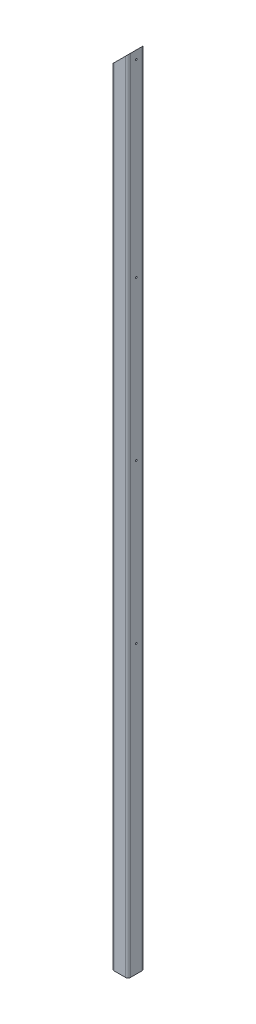
from build123d import *

# Parameters (mm, degrees)
TUBE_SQUARE_40_X_40_X_3_2_1_DEPTH = 1920
CUT_EXTRUDE1_DEPTH                = 1921.52076271
SKETCH16_R                        = 2
CUT_EXTRUDE2_DEPTH                = 3


with BuildPart() as part:
    # Sketch15 → Tube (square) 40 X 40 X 3.2(1) (new body)
    with BuildSketch(Plane(origin=(0, 0, 0), x_dir=(-1, 0, 0), z_dir=(0, 1, 0))):
        with BuildLine():
            Line((-13.6, -20), (13.6, -20))
            ThreePointArc((13.6, -20), (18.1254834, -18.1254834), (20, -13.6))
            Line((20, -13.6), (20, 13.6))
            ThreePointArc((20, 13.6), (18.1254834, 18.1254834), (13.6, 20))
            Line((13.6, 20), (-13.6, 20))
            ThreePointArc((-13.6, 20), (-18.1254834, 18.1254834), (-20, 13.6))
            Line((-20, 13.6), (-20, -13.6))
            ThreePointArc((-20, -13.6), (-18.1254834, -18.1254834), (-13.6, -20))
        make_face()
        with BuildLine():
            Line((-13.6, -16.8), (13.6, -16.8))
            ThreePointArc((13.6, -16.8), (15.8627417, -15.8627417), (16.8, -13.6))
            Line((16.8, -13.6), (16.8, 13.6))
            ThreePointArc((16.8, 13.6), (15.8627417, 15.8627417), (13.6, 16.8))
            Line((13.6, 16.8), (-13.6, 16.8))
            ThreePointArc((-13.6, 16.8), (-15.8627417, 15.8627417), (-16.8, 13.6))
            Line((-16.8, 13.6), (-16.8, -13.6))
            ThreePointArc((-16.8, -13.6), (-15.8627417, -15.8627417), (-13.6, -16.8))
        make_face(mode=Mode.SUBTRACT)
    extrude(amount=TUBE_SQUARE_40_X_40_X_3_2_1_DEPTH)

    # Sketch13 → Cut-Extrude1 (cut, through all)
    with BuildSketch(Plane(origin=(0, 0, -20), x_dir=(-1, 0, 0), z_dir=(0, 0, -1))):
        Polygon((20, 1880), (-20, 1920), (20, 1920), align=None)
    extrude(amount=-CUT_EXTRUDE1_DEPTH, mode=Mode.SUBTRACT)

    # Sketch16 → Cut-Extrude2 (cut)
    with BuildSketch(Plane(origin=(20, 0, 0), x_dir=(0, 0, -1), z_dir=(1, 0, 0))):
        with Locations((0, 1900)):
            Circle(SKETCH16_R)
        with Locations((0, 1447)):
            Circle(SKETCH16_R)
        with Locations((0, 1067)):
            Circle(SKETCH16_R)
        with Locations((0, 687)):
            Circle(SKETCH16_R)
    extrude(amount=-CUT_EXTRUDE2_DEPTH, mode=Mode.SUBTRACT)


solid = part.part
